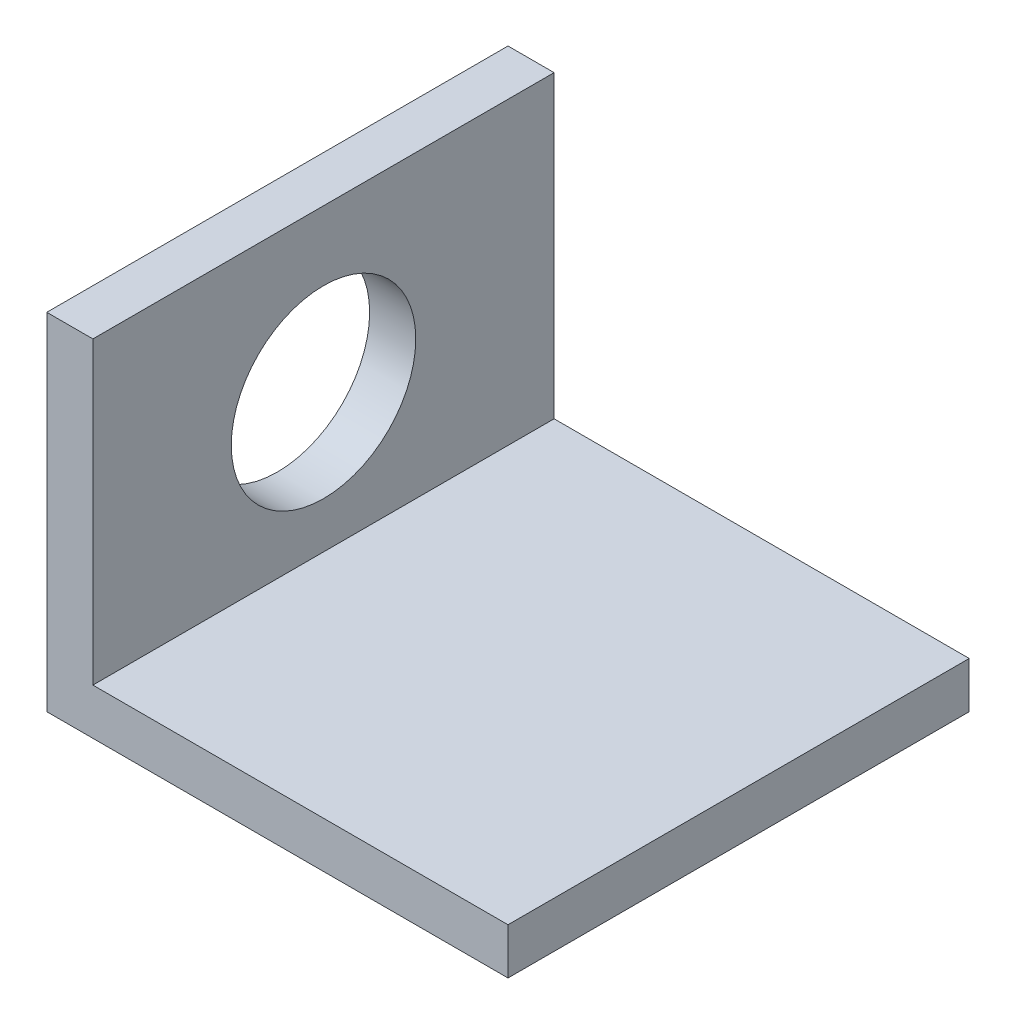
from build123d import *

# Parameters (mm, degrees)
AUFSATZ_LINEAR_AUSTRAGEN1_DEPTH = 10
SKIZZE2_R                       = 2
SCHNITT_LINEAR_AUSTRAGEN1_DEPTH = 16.564382416


with BuildPart() as part:
    # Skizze1 → Aufsatz-Linear austragen1 (new body)
    with BuildSketch(Plane.XY):
        Polygon((0, 0), (0, 6.5), (-1, 6.5), (-1, -1), (9, -1), (9, 0), align=None)
    extrude(amount=AUFSATZ_LINEAR_AUSTRAGEN1_DEPTH)

    # Skizze2 → Schnitt-Linear austragen1 (cut, through all)
    with BuildSketch(Plane.ZY.offset(1)):
        with Locations((5, 3)):
            Circle(SKIZZE2_R)
    extrude(amount=-SCHNITT_LINEAR_AUSTRAGEN1_DEPTH, mode=Mode.SUBTRACT)


solid = part.part
